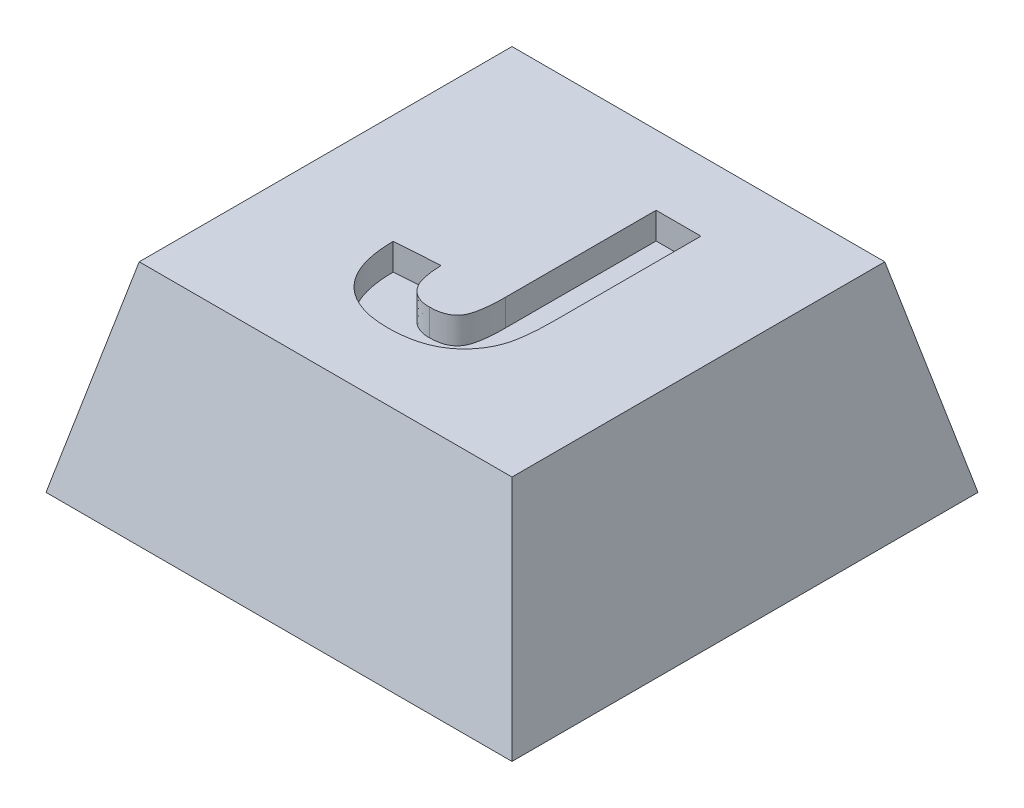
from build123d import *

# Parameters (mm, degrees)
SKETCH1_W           = 7
SKETCH1_H           = 7
BOSS_EXTRUDE1_DEPTH = 3
CUT_EXTRUDE1_DEPTH  = 7
CUT_EXTRUDE2_DEPTH  = 11
SKETCH4_R           = 1.8
CUT_EXTRUDE3_DEPTH  = 0.8
CUT_EXTRUDE4_DEPTH  = 0.4


with BuildPart() as part:
    # Sketch1 → Boss-Extrude1 (new body)
    with BuildSketch(Plane(origin=(0, 0, 0), x_dir=(1, 0, 0), z_dir=(0, 1, 0))):
        with Locations((3.5, 3.5)):
            Rectangle(SKETCH1_W, SKETCH1_H)
    extrude(amount=BOSS_EXTRUDE1_DEPTH)

    # Sketch2 → Cut-Extrude1 (cut)
    with BuildSketch(Plane.XY):
        Polygon((0, 0), (0.7, 3), (0, 3), align=None)
        Polygon((7, 0), (6.3, 3), (7, 3), align=None)
    extrude(amount=-CUT_EXTRUDE1_DEPTH, mode=Mode.SUBTRACT)

    # Sketch3 → Cut-Extrude2 (cut)
    with BuildSketch(Plane(origin=(0, 0, 0), x_dir=(0, 0, -1), z_dir=(1, 0, 0))):
        Polygon((0, 0), (0.7, 3), (0, 3), align=None)
        Polygon((7, 3), (6.3, 3), (7, 0), align=None)
    extrude(amount=CUT_EXTRUDE2_DEPTH, mode=Mode.SUBTRACT)

    # Sketch4 → Cut-Extrude3 (cut)
    with BuildSketch(Plane.XZ):
        with Locations(Location((3.5, -3.5, 0), (0, 0, 270))):
            Circle(SKETCH4_R)
    extrude(amount=-CUT_EXTRUDE3_DEPTH, mode=Mode.SUBTRACT)

    # Sketch5 → Cut-Extrude4 (cut)
    with BuildSketch(Plane(origin=(0, 3, 0), x_dir=(1, 0, 0), z_dir=(0, 1, 0))):
        with BuildLine():
            Line((3.912067399, 5.252535384), (4.585144322, 5.252535384))
            Line((4.585144322, 5.252535384), (4.585144322, 3.046105095))
            add(Edge.make_bspline(
                [(4.585144322, 3.046105095), (4.584843541, 3.011045712), (4.584259872, 2.943012724), (4.580673506, 2.844127733), (4.575337598, 2.751510265), (4.567129137, 2.665173613), (4.555562948, 2.585304416), (4.543305201, 2.511265579), (4.528422816, 2.443431307), (4.515086598, 2.400993469), (4.508722046, 2.380740512)],
                knots=[0, 0, 0, 0, 1.251619961, 2.428777588, 3.532126049, 4.56323557, 5.523704531, 6.412540087, 7.242403515, 8, 8, 8, 8], degree=3))
            add(Edge.make_bspline(
                [(4.508722046, 2.380740512), (4.499827513, 2.355783352), (4.482224719, 2.306391691), (4.448010513, 2.235936597), (4.408665944, 2.169234852), (4.364301741, 2.105997397), (4.315336945, 2.04597069), (4.260110759, 1.990736894), (4.200565892, 1.938369412), (4.135027413, 1.891038204), (4.06514476, 1.846907146), (3.988927236, 1.810138919), (3.907874454, 1.778333915), (3.821306158, 1.752500626), (3.729197248, 1.73228764), (3.631783693, 1.717575234), (3.528935725, 1.70921534), (3.458690461, 1.708189441), (3.422684386, 1.707663589)],
                knots=[0, 0, 0, 0, 0.925533072, 1.831683394, 2.73255258, 3.630007683, 4.529542467, 5.436465751, 6.357118906, 7.298274949, 8.259461937, 9.242242071, 10.251058183, 11.300341426, 12.396409345, 13.544807631, 14.74152597, 16, 16, 16, 16], degree=3))
            add(Edge.make_bspline(
                [(3.422684386, 1.707663589), (3.380583904, 1.708681136), (3.298736769, 1.71065934), (3.179715358, 1.723792805), (3.068099561, 1.746763788), (2.964225235, 1.779943292), (2.867030957, 1.8211886), (2.777692308, 1.872636461), (2.695734484, 1.93325469), (2.62169044, 2.003229079), (2.555523571, 2.081852015), (2.498409733, 2.169813315), (2.449935297, 2.266193101), (2.410873173, 2.371427394), (2.380033539, 2.485012376), (2.357789346, 2.607187203), (2.344515975, 2.738021444), (2.342560592, 2.828024877), (2.341554578, 2.874330256)],
                knots=[0, 0, 0, 0, 1.114068574, 2.165849827, 3.164101702, 4.124467949, 5.046988974, 5.952942428, 6.846011651, 7.738523925, 8.642829306, 9.558838605, 10.50752403, 11.491963144, 12.524197802, 13.618364352, 14.774685164, 16, 16, 16, 16], degree=3))
            Line((2.341554578, 2.874330256), (3.014631501, 2.919202051))
            add(Edge.make_bspline(
                [(3.014631501, 2.919202051), (3.015840364, 2.894415849), (3.018158425, 2.846886919), (3.024594885, 2.778371834), (3.032733918, 2.715398444), (3.043383675, 2.658155757), (3.054852287, 2.60616009), (3.069750194, 2.560434701), (3.085412304, 2.519371749), (3.099168906, 2.495346649), (3.105777335, 2.483805416)],
                knots=[0, 0, 0, 0, 1.326609226, 2.543847584, 3.678365909, 4.719972403, 5.656527627, 6.521948534, 7.28997025, 8, 8, 8, 8], degree=3))
            add(Edge.make_bspline(
                [(3.105777335, 2.483805416), (3.115894166, 2.468540683), (3.135805351, 2.438497786), (3.17212863, 2.399348731), (3.211125287, 2.365122439), (3.254928677, 2.338213709), (3.302319529, 2.317050802), (3.353653599, 2.301673045), (3.408789357, 2.292348698), (3.446718972, 2.2914549), (3.466153937, 2.290996922)],
                knots=[0, 0, 0, 0, 1.023658308, 2.014687051, 2.979722519, 3.920049697, 4.880550909, 5.878122304, 6.912759386, 8, 8, 8, 8], degree=3))
            add(Edge.make_bspline(
                [(3.466153937, 2.290996922), (3.485804159, 2.291363098), (3.523578154, 2.292067004), (3.578014864, 2.298467893), (3.628066722, 2.308839798), (3.673760989, 2.323419076), (3.715252451, 2.342345121), (3.751621411, 2.366557721), (3.784435046, 2.393802377), (3.812780846, 2.426575807), (3.836932023, 2.466065164), (3.857097159, 2.514128918), (3.874444677, 2.57096477), (3.887851723, 2.637004807), (3.899263762, 2.7116168), (3.906422298, 2.795460452), (3.911567905, 2.88828796), (3.911896247, 2.953314858), (3.912067399, 2.987210865)],
                knots=[0, 0, 0, 0, 0.980314827, 1.884477813, 2.730827652, 3.527503874, 4.27366112, 4.998269146, 5.70163477, 6.396145331, 7.150281155, 8.001758491, 8.990432449, 10.111292654, 11.361572691, 12.75538406, 14.308707205, 16, 16, 16, 16], degree=3))
            Line((3.912067399, 2.987210865), (3.912067399, 5.252535384))
        make_face()
    extrude(amount=-CUT_EXTRUDE4_DEPTH, mode=Mode.SUBTRACT)


solid = part.part
